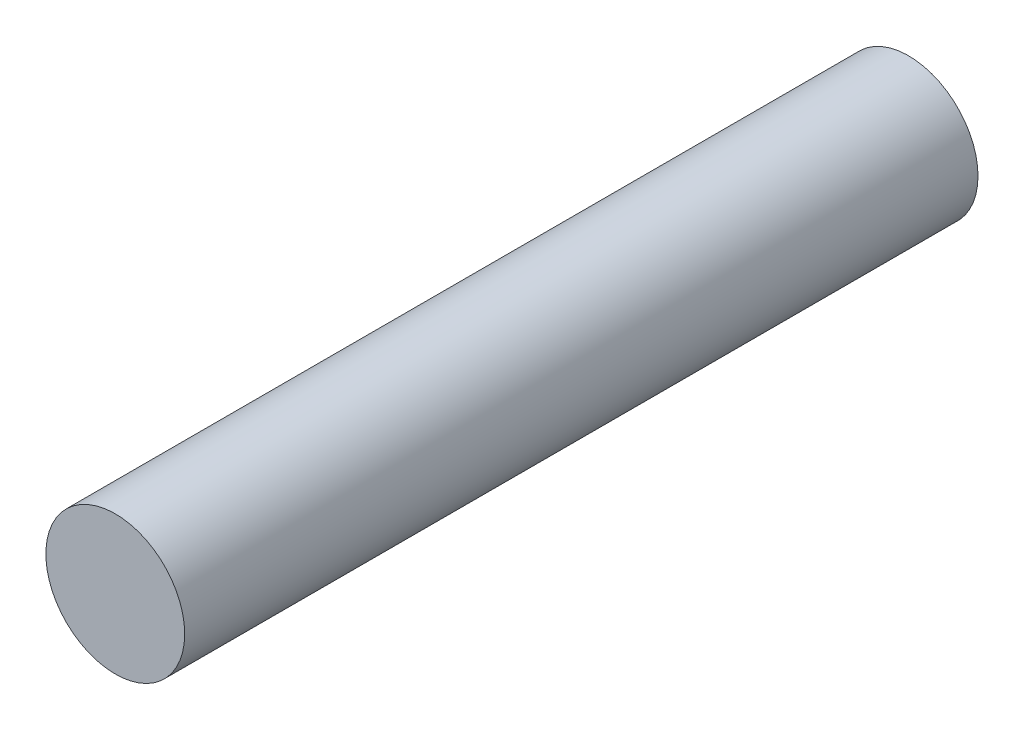
from build123d import *

# Parameters (mm, degrees)
SKETCH1_R           = 1.75
BOSS_EXTRUDE1_DEPTH = 20


with BuildPart() as part:
    # Sketch1 → Boss-Extrude1 (new body)
    with BuildSketch(Plane.XY):
        Circle(SKETCH1_R)
    extrude(amount=BOSS_EXTRUDE1_DEPTH)


solid = part.part
